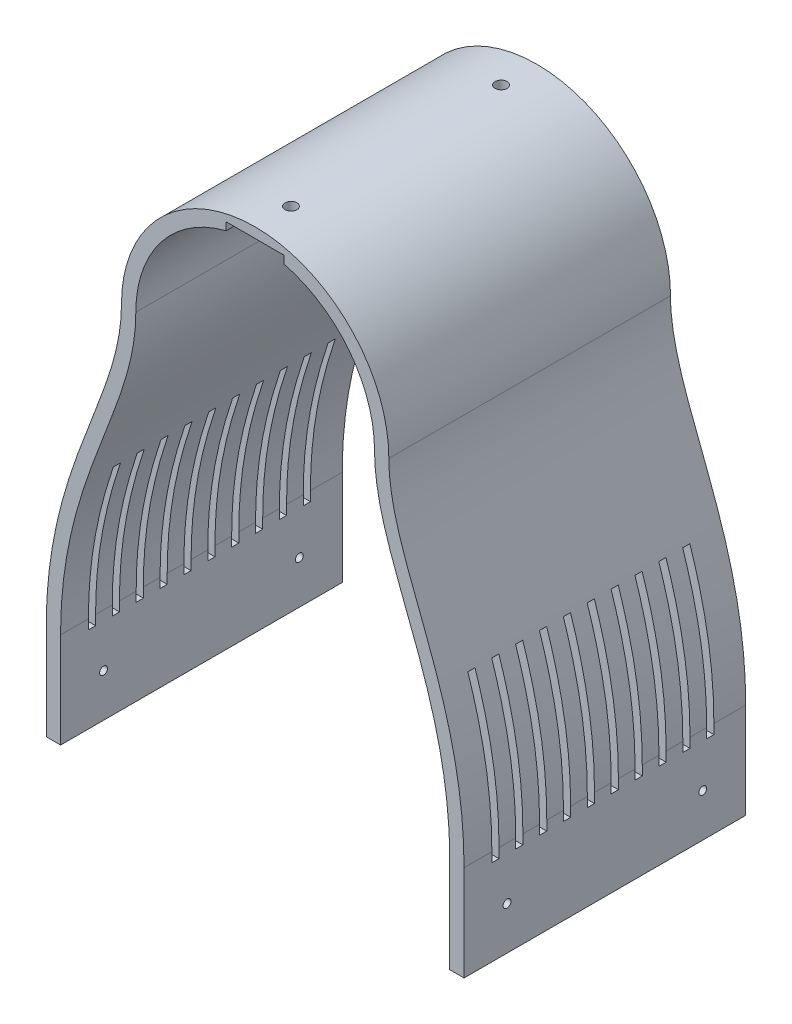
from build123d import *

# Parameters (mm, degrees)
BOSS_EXTRUDE1_DEPTH     = 118
CUT_EXTRUDE1_DEPTH      = 312.255743247
CUT_EXTRUDE1_DEPTH_BACK = 312.255743247
SKETCH2_W               = 3
SKETCH2_H               = 64.252631743
CUT_EXTRUDE4_DEPTH      = 312.255743247
CUT_EXTRUDE4_DEPTH_BACK = 312.255743247
SKETCH4_R               = 1.65
SKETCH5_W               = 24.310491562
SKETCH5_H               = 4
CUT_EXTRUDE5_DEPTH      = 272.866488716
SKETCH6_R               = 2.5
CUT_EXTRUDE7_DEPTH      = 10


with BuildPart() as part:
    # Sketch1 → Boss-Extrude1 (new body)
    with BuildSketch(Plane.XY):
        with BuildLine():
            Line((-87.5, 0), (-81.5, 0))
            Line((-81.5, 0), (-81.5, 40))
            add(Edge.make_bspline(
                [(-81.5, 40), (-81.5, 101.485137293), (-50, 134.622814305), (-50, 172.76)],
                knots=[0.172808474, 0.172808474, 0.172808474, 0.172808474, 1.172808474, 1.172808474, 1.172808474, 1.172808474], degree=3))
            ThreePointArc((-50, 172.76), (0, 222.76), (50, 172.76))
            add(Edge.make_bspline(
                [(50, 172.76), (50, 134.622814305), (81.5, 101.485137293), (81.5, 40)],
                knots=[0, 0, 0, 0, 1, 1, 1, 1], degree=3))
            Line((81.5, 40), (81.5, 0))
            Line((81.5, 0), (87.5, 0))
            Line((87.5, 0), (87.5, 40))
            add(Edge.make_bspline(
                [(87.5, 40), (87.5, 40.985830291), (87.48410618, 42.967374201), (87.390687748, 46.850642244), (87.162019789, 51.611890304), (86.720428983, 57.164261862), (85.924728142, 64.365116734), (84.572421586, 72.995978332), (82.475882462, 82.80061538), (80.005556824, 92.093041409), (76.347327797, 103.856028398), (71.342550398, 117.491782351), (65.436492984, 132.49743438), (60.388338668, 146.481137551), (56.896324358, 159.77707038), (56, 168.391511905), (56, 172.76)],
                knots=[0, 0, 0, 0, 0.015625, 0.03125, 0.0625, 0.09375, 0.125, 0.1875, 0.25, 0.3125, 0.375, 0.5, 0.625, 0.75, 0.875, 1, 1, 1, 1], degree=3))
            ThreePointArc((56, 172.76), (0, 228.76), (-56, 172.76))
            add(Edge.make_bspline(
                [(-56, 172.76), (-56, 168.391511905), (-56.896324358, 159.77707038), (-60.388338668, 146.481137551), (-65.436492984, 132.49743438), (-71.342550398, 117.491782351), (-76.347327797, 103.856028398), (-80.005556824, 92.093041409), (-82.475882462, 82.80061538), (-84.572421586, 72.995978332), (-85.924728142, 64.365116734), (-86.720428983, 57.164261862), (-87.162019789, 51.611890304), (-87.390687748, 46.850642244), (-87.48410618, 42.967374201), (-87.5, 40.985830291), (-87.5, 40)],
                knots=[0, 0, 0, 0, 0.125, 0.25, 0.375, 0.5, 0.625, 0.6875, 0.75, 0.8125, 0.875, 0.90625, 0.9375, 0.96875, 0.984375, 1, 1, 1, 1], degree=3))
            Line((-87.5, 40), (-87.5, 0))
        make_face()
    extrude(amount=BOSS_EXTRUDE1_DEPTH)

    # Sketch2 → Cut-Extrude1 (cut, two sides: drawn at the far end of the back side and taken through both)
    with BuildSketch(Plane(origin=(87.5, 0, 0), x_dir=(0, 0, -1), z_dir=(1, 0, 0)).offset(-CUT_EXTRUDE1_DEPTH_BACK)):
        with Locations((-44.841427718, 68.09695716)):
            Rectangle(SKETCH2_W, SKETCH2_H)
        with Locations((-64.841427718, 68.09695716)):
            Rectangle(SKETCH2_W, SKETCH2_H)
        with Locations((-54.841427718, 68.09695716)):
            Rectangle(SKETCH2_W, SKETCH2_H)
        with Locations((-74.841427718, 68.09695716)):
            Rectangle(SKETCH2_W, SKETCH2_H)
        with Locations((-34.841427718, 68.09695716)):
            Rectangle(SKETCH2_W, SKETCH2_H)
        with Locations((-24.841427718, 68.09695716)):
            Rectangle(SKETCH2_W, SKETCH2_H)
        with Locations((-14.841427718, 68.09695716)):
            Rectangle(SKETCH2_W, SKETCH2_H)
        with Locations((-84.841427718, 68.09695716)):
            Rectangle(SKETCH2_W, SKETCH2_H)
        with Locations((-94.841427718, 68.09695716)):
            Rectangle(SKETCH2_W, SKETCH2_H)
        with Locations((-104.841427718, 68.09695716)):
            Rectangle(SKETCH2_W, SKETCH2_H)
    extrude(amount=CUT_EXTRUDE1_DEPTH + CUT_EXTRUDE1_DEPTH_BACK, mode=Mode.SUBTRACT)

    # Sketch4 → Cut-Extrude4 (cut, two sides: drawn at the far end of the back side and taken through both)
    with BuildSketch(Plane(origin=(87.5, 0, 0), x_dir=(0, 0, -1), z_dir=(1, 0, 0)).offset(-CUT_EXTRUDE4_DEPTH_BACK)):
        with Locations((-100, 18)):
            Circle(SKETCH4_R)
        with Locations((-18, 18)):
            Circle(SKETCH4_R)
    extrude(amount=CUT_EXTRUDE4_DEPTH + CUT_EXTRUDE4_DEPTH_BACK, mode=Mode.SUBTRACT)

    # Sketch5 → Cut-Extrude5 (cut, through all)
    with BuildSketch(Plane.XY.offset(118)):
        with Locations((0, 222.5234)):
            Rectangle(SKETCH5_W, SKETCH5_H)
    extrude(amount=-CUT_EXTRUDE5_DEPTH, mode=Mode.SUBTRACT)

    # Sketch6 → Cut-Extrude7 (cut)
    with BuildSketch(Plane(origin=(0, 224.5234, 0), x_dir=(-1, 0, 0), z_dir=(0, 1, 0))):
        with Locations((0, 103)):
            Circle(SKETCH6_R)
        with Locations((0, 15)):
            Circle(SKETCH6_R)
    extrude(amount=CUT_EXTRUDE7_DEPTH, mode=Mode.SUBTRACT)


solid = part.part
